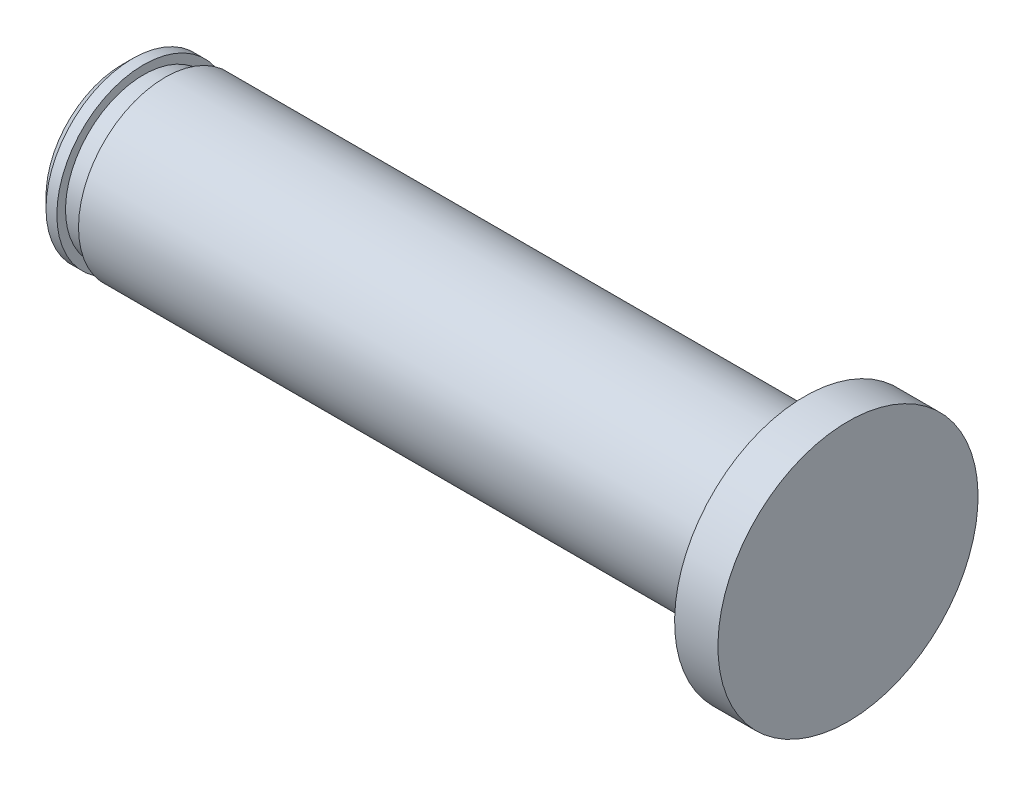
from build123d import *

# Parameters (mm, degrees)
CHAMFER_1_SIZE = 0.5


with BuildPart() as part:
    # Эскиз1 → Повернуть1 (revolve)
    with BuildSketch(Plane.XY, mode=Mode.PRIVATE) as revolve_1_sk:
        Polygon((0, 0), (-33.5, 0), (-33.5, 4), (-32.5, 4), (-32.5, 3.6), (-31.5, 3.6), (-31.5, 4), (-2, 4), (-2, 6), (0, 6), align=None)
    revolve(revolve_1_sk.sketch.rotate(Axis((-33.5, 0, 0), (1, 0, 0)), 180), axis=Axis((-33.5, 0, 0), (1, 0, 0)))

    # Фаска1
    chamfer_1_edges = [part.edges().sort_by_distance(p)[0] for p in [
        (-33.5, 4, 0),
    ]]
    chamfer(chamfer_1_edges, length=CHAMFER_1_SIZE)


solid = part.part
